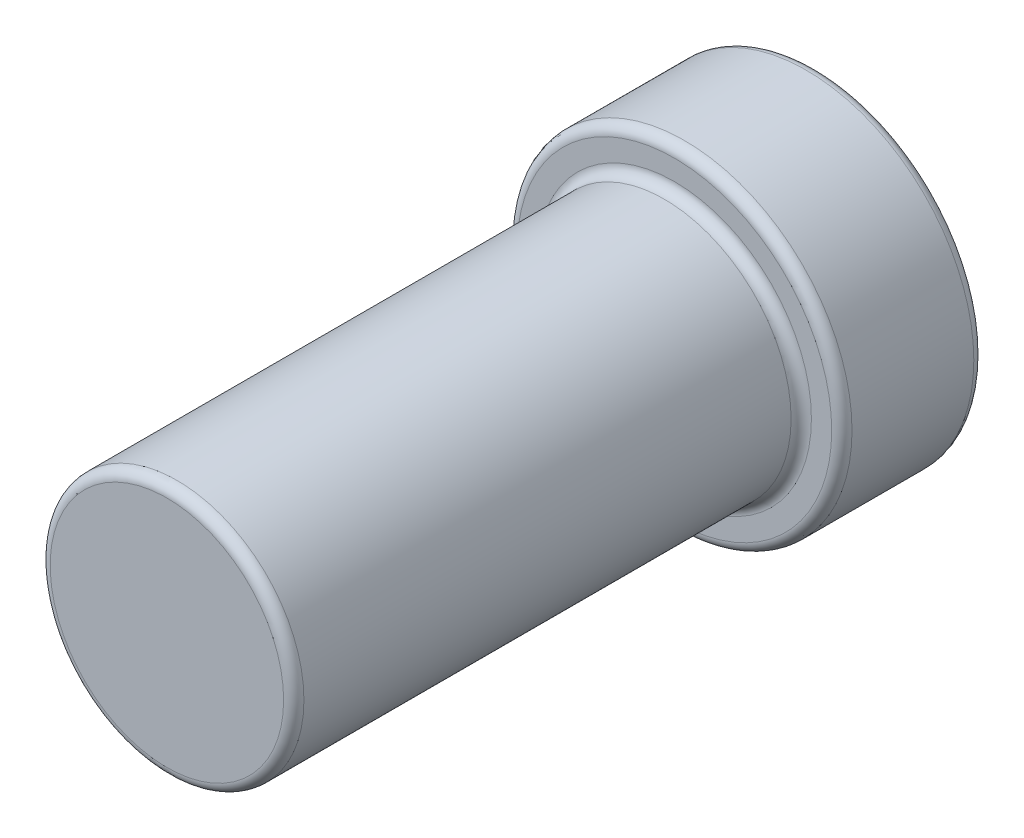
from build123d import *

# Parameters (mm, degrees)
SKETCH1_R           = 1.65
BOSS_EXTRUDE1_DEPTH = 1.4
SKETCH2_R           = 1.25
BOSS_EXTRUDE2_DEPTH = 5
CUT_EXTRUDE1_DEPTH  = 1.3
FILLET1_R           = 0.1
SKETCH4_W           = 0.352777778
SKETCH4_H           = 0.176388889
SKETCH4_W_2         = 0.352777777
SKETCH4_H_2         = 0.044097222
BOSS_EXTRUDE3_DEPTH = 0.1


with BuildPart() as part:
    # Sketch1 → Boss-Extrude1 (new body)
    with BuildSketch(Plane.XY):
        Circle(SKETCH1_R)
    extrude(amount=BOSS_EXTRUDE1_DEPTH)

    # Sketch2 → Boss-Extrude2 (add)
    with BuildSketch(Plane.XY.offset(1.4)):
        Circle(SKETCH2_R)
    extrude(amount=BOSS_EXTRUDE2_DEPTH)

    # Sketch3 → Cut-Extrude1 (cut)
    with BuildSketch(Plane(origin=(0, 0, 0), x_dir=(-1, 0, 0), z_dir=(0, 0, -1))):
        Polygon((1.288941176, 0), (0.644470588, 1.116255803), (-0.644470588, 1.116255803), (-1.288941176, 0), (-0.644470588, -1.116255803), (0.644470588, -1.116255803), align=None)
    extrude(amount=-CUT_EXTRUDE1_DEPTH, mode=Mode.SUBTRACT)

    # Fillet1
    fillet1_edges = [part.edges().sort_by_distance(p)[0] for p in [
        (-0.966705882, -0.558127901, 1.3),
        (-1.288941176, 0, 0.65),
        (0, -1.116255803, 1.3),
        (-0.644470588, -1.116255803, 0.65),
        (0.966705882, -0.558127901, 1.3),
        (0.644470588, -1.116255803, 0.65),
        (0.966705882, 0.558127901, 1.3),
        (1.288941176, 0, 0.65),
        (0, 1.116255803, 1.3),
        (0.644470588, 1.116255803, 0.65),
        (-0.966705882, 0.558127901, 1.3),
        (-0.644470588, 1.116255803, 0.65),
        (-0.966705882, -0.558127901, 0),
        (-0.966705882, 0.558127901, 0),
        (0, 1.116255803, 0),
        (0.966705882, 0.558127901, 0),
        (0.966705882, -0.558127901, 0),
        (0, -1.116255803, 0),
        (-1.65, 0, 0),
        (-1.65, 0, 1.4),
        (-1.25, 0, 1.4),
        (-1.25, 0, 6.4),
    ]]
    fillet(fillet1_edges, radius=FILLET1_R)

    # Sketch4 → Boss-Extrude3 (add)
    # profile 1 of 3: a face of its own
    with BuildSketch(Plane(origin=(0, 0, 1.3), x_dir=(-1, 0, 0), z_dir=(0, 0, -1))):
        Polygon((-0.829270588, -0.274385784), (-0.829270588, 0.21068366), (-0.300103922, 0.21068366), (-0.300103922, -0.142094118), (-0.741076144, -0.142094118), (-0.741076144, -0.274385784), align=None)
        with Locations((-0.564687255, 0.034294772)):
            Rectangle(SKETCH4_W, SKETCH4_H, mode=Mode.SUBTRACT)
    # profile 2 of 3: a face of its own
    with BuildSketch(Plane(origin=(0, 0, 1.3), x_dir=(-1, 0, 0), z_dir=(0, 0, -1))):
        Polygon((-0.254373469, -0.142094118), (-0.254373469, 0.078391993), (0.186598753, 0.078391993), (0.186598753, 0.122489216), (-0.254373469, 0.122489216), (-0.254373469, 0.21068366), (0.274793198, 0.21068366), (0.274793198, -0.142094118), align=None)
        with Locations((0.010209864, -0.031851062)):
            Rectangle(SKETCH4_W_2, SKETCH4_H_2, mode=Mode.SUBTRACT)
    # profile 3 of 3: a face of its own
    with BuildSketch(Plane(origin=(0, 0, 1.3), x_dir=(-1, 0, 0), z_dir=(0, 0, -1))):
        Polygon((0.32052365, -0.142094118), (0.32052365, 0.034294771), (0.541009762, 0.034294771), (0.541009762, 0.078391993), (0.32052365, 0.078391993), (0.32052365, 0.21068366), (0.408718095, 0.21068366), (0.408718095, 0.166586438), (0.761495873, 0.166586438), (0.761495873, 0.21068366), (0.849690317, 0.21068366), (0.849690317, 0.078391993), (0.629204206, 0.078391993), (0.629204206, 0.034294771), (0.849690317, 0.034294771), (0.849690317, -0.142094118), (0.761495873, -0.142094118), (0.761495873, -0.053899673), (0.408718095, -0.053899673), (0.408718095, -0.142094118), align=None)
    extrude(amount=BOSS_EXTRUDE3_DEPTH)


solid = part.part
